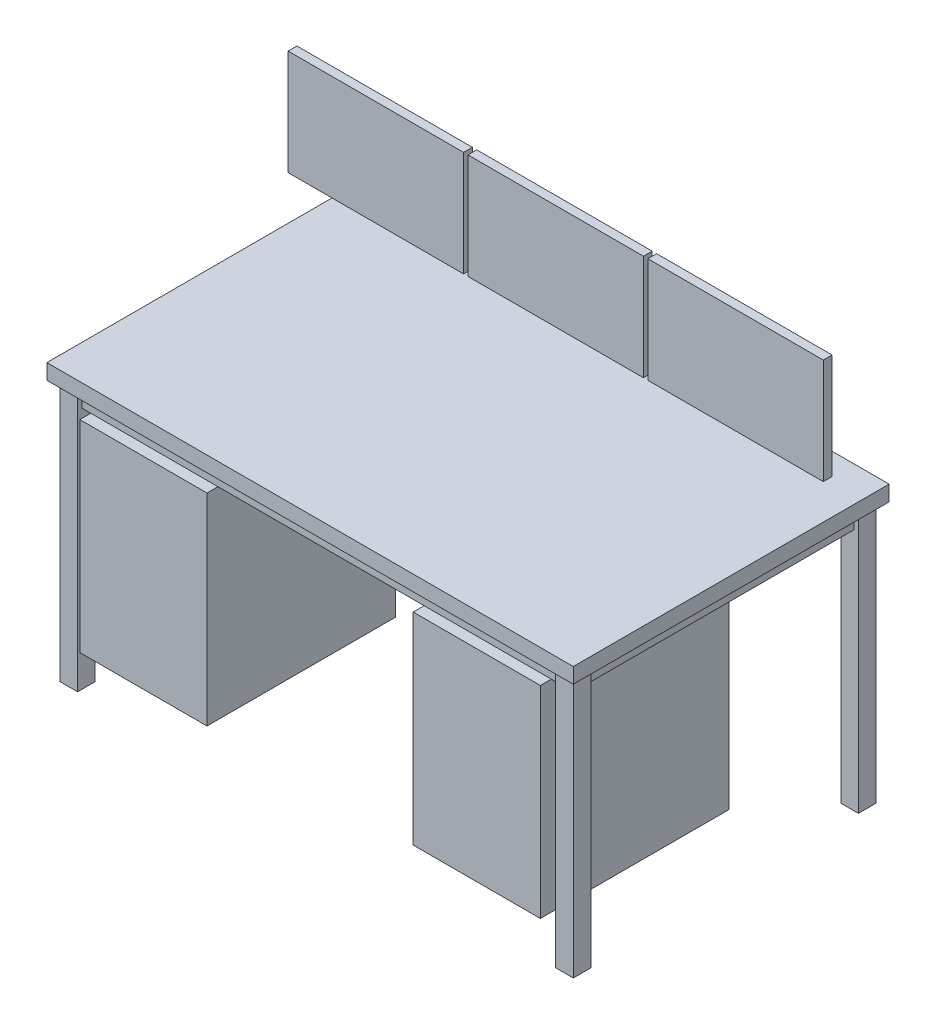
from build123d import *

# Parameters (mm, degrees)
SKETCH1_W             = 1524
SKETCH1_H             = 914.4
BOSS_EXTRUDE1_DEPTH   = 44.45
SKETCH2_W             = 50.8
SKETCH2_H             = 50.8
BOSS_EXTRUDE2_DEPTH   = 755.65
SKETCH3_W             = 1460.5
SKETCH3_H             = 850.9
SKETCH3_W_2           = 1409.7
SKETCH3_H_2           = 800.1
BOSS_EXTRUDE3_DEPTH   = 50.8
SKETCH4_W             = 368.3
SKETCH4_H             = 546.1
BOSS_EXTRUDE4_DEPTH   = 584.2
SKETCH5_W             = 508
SKETCH5_H             = 304.8
BOSS_EXTRUDE5_DEPTH   = 25.4
BOSS_EXTRUDE5_2_DEPTH = 25.4
BOSS_EXTRUDE5_3_DEPTH = 25.4


with BuildPart() as part:
    # Sketch1 → Boss-Extrude1 (new body)
    with BuildSketch(Plane(origin=(0, 0, 0), x_dir=(1, 0, 0), z_dir=(0, 1, 0))):
        Rectangle(SKETCH1_W, SKETCH1_H)
    extrude(amount=-BOSS_EXTRUDE1_DEPTH)

    # Sketch2 → Boss-Extrude2 (add)
    with BuildSketch(Plane.XZ.offset(44.45)):
        with Locations((717.55, 412.75)):
            Rectangle(SKETCH2_W, SKETCH2_H)
        with Locations((717.55, -412.75)):
            Rectangle(SKETCH2_W, SKETCH2_H)
        with Locations((-717.55, -412.75)):
            Rectangle(SKETCH2_W, SKETCH2_H)
        with Locations((-717.55, 412.75)):
            Rectangle(SKETCH2_W, SKETCH2_H)
    extrude(amount=BOSS_EXTRUDE2_DEPTH)

    # Sketch3 → Boss-Extrude3 (add)
    with BuildSketch(Plane.XZ.offset(44.45)):
        Rectangle(SKETCH3_W, SKETCH3_H)
        Rectangle(SKETCH3_W_2, SKETCH3_H_2, mode=Mode.SUBTRACT)
    extrude(amount=BOSS_EXTRUDE3_DEPTH)

    # Sketch4 → Boss-Extrude4 (add)
    with BuildSketch(Plane.XZ.offset(95.25)):
        with Locations((-482.6, 184.15)):
            Rectangle(SKETCH4_W, SKETCH4_H)
        with Locations((482.6, 184.15)):
            Rectangle(SKETCH4_W, SKETCH4_H)
    extrude(amount=BOSS_EXTRUDE4_DEPTH)


with BuildPart() as body_2:
    # Sketch5 → Boss-Extrude5 (new body)
    with BuildSketch(Plane.XY.offset(-254)):
        with Locations((-520.7, 266.7)):
            Rectangle(SKETCH5_W, SKETCH5_H)
    extrude(amount=-BOSS_EXTRUDE5_DEPTH)


with BuildPart() as body_3:
    # Sketch5 → Boss-Extrude5 2 (new body)
    with BuildSketch(Plane.XY.offset(-254)):
        with Locations((0, 266.7)):
            Rectangle(SKETCH5_W, SKETCH5_H)
    extrude(amount=-BOSS_EXTRUDE5_2_DEPTH)


with BuildPart() as body_4:
    # Sketch5 → Boss-Extrude5 3 (new body)
    with BuildSketch(Plane.XY.offset(-254)):
        with Locations((520.7, 266.7)):
            Rectangle(SKETCH5_W, SKETCH5_H)
    extrude(amount=-BOSS_EXTRUDE5_3_DEPTH)


solid = Compound([part.part, body_2.part, body_3.part, body_4.part])
